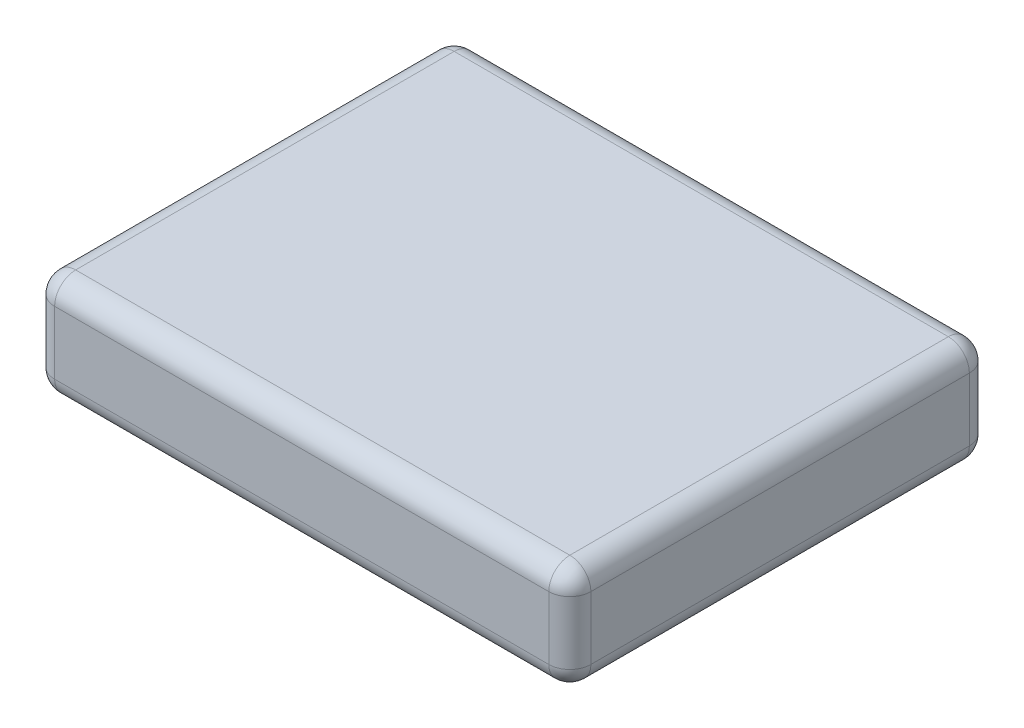
from build123d import *

# Parameters (mm, degrees)
SKETCH1_W           = 25.5
SKETCH1_H           = 20
BOSS_EXTRUDE1_DEPTH = 5
FILLET1_R           = 1


with BuildPart() as part:
    # Sketch1 → Boss-Extrude1 (new body)
    with BuildSketch(Plane(origin=(0, 0, 0), x_dir=(1, 0, 0), z_dir=(0, 1, 0))):
        Rectangle(SKETCH1_W, SKETCH1_H)
    extrude(amount=BOSS_EXTRUDE1_DEPTH)

    # Fillet1
    fillet1_edges = [part.edges().sort_by_distance(p)[0] for p in [
        (-12.75, 5, 0),
        (0, 5, 10),
        (12.75, 5, 0),
        (0, 0, 10),
        (-12.75, 0, 0),
        (0, 0, -10),
        (12.75, 0, 0),
        (12.75, 2.5, 10),
        (-12.75, 2.5, 10),
        (-12.75, 2.5, -10),
        (12.75, 2.5, -10),
        (0, 5, -10),
    ]]
    fillet(fillet1_edges, radius=FILLET1_R)


solid = part.part
